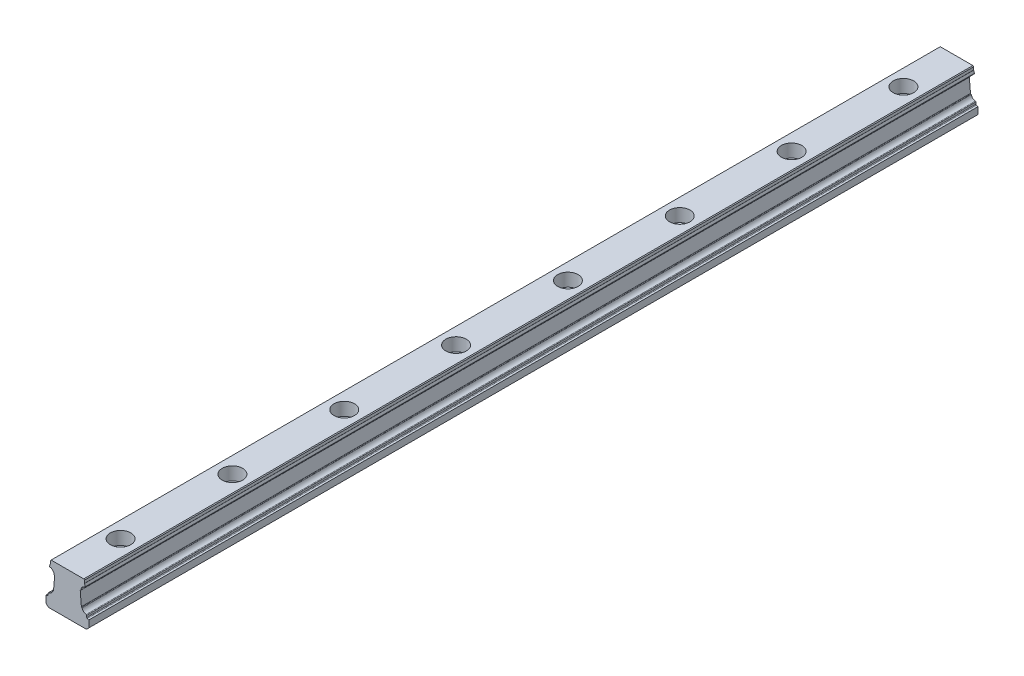
from build123d import *

# Parameters (mm, degrees)
EXTRUDE1_DEPTH                                      = 238.5
CBORE_FOR_M6_HEX_SOCKET_HEAD_CAP_SCREW1_D           = 6.6
CBORE_FOR_M6_HEX_SOCKET_HEAD_CAP_SCREW1_CBORE_D     = 11
CBORE_FOR_M6_HEX_SOCKET_HEAD_CAP_SCREW1_CBORE_DEPTH = 7
LPATTERN2_COUNT                                     = 8
LPATTERN2_PITCH                                     = 60


with BuildPart() as part:
    # Sketch1 → Extrude1 (new, symmetric)
    with BuildSketch(Plane.XY):
        with BuildLine():
            Line((7.477203841, -2.163774891), (6.854635535, 4.95221341))
            ThreePointArc((6.854635535, 4.95221341), (6.894238652, 5.113219257), (7.023920881, 5.216533386))
            ThreePointArc((7.023920881, 5.216533386), (7.143282835, 5.304921447), (7.19380984, 5.444588005))
            ThreePointArc((7.19380984, 5.444588005), (7.842791864, 6.982656014), (9.322818427, 7.754894477))
            ThreePointArc((9.322818427, 7.754894477), (9.570098719, 7.917497666), (9.598759922, 8.212058144))
            Line((9.598759922, 8.212058144), (9.174122952, 9.378738633))
            ThreePointArc((9.174122952, 9.378738633), (9.156076899, 9.446087419), (9.15, 9.51554669))
            Line((9.15, 9.51554669), (9.15, 10.95))
            Line((9.15, 10.95), (8.75, 11.35))
            Line((8.75, 11.35), (-8.75, 11.35))
            Line((-8.75, 11.35), (-9.15, 10.95))
            Line((-9.15, 10.95), (-9.15, 9.51554669))
            ThreePointArc((-9.15, 9.51554669), (-9.156076899, 9.446087419), (-9.174122952, 9.378738633))
            Line((-9.174122952, 9.378738633), (-9.598759922, 8.212058144))
            ThreePointArc((-9.598759922, 8.212058144), (-9.570098719, 7.917497666), (-9.322818427, 7.754894477))
            ThreePointArc((-9.322818427, 7.754894477), (-7.842791864, 6.982656014), (-7.19380984, 5.444588005))
            ThreePointArc((-7.19380984, 5.444588005), (-7.143282835, 5.304921447), (-7.023920881, 5.216533386))
            ThreePointArc((-7.023920881, 5.216533386), (-6.894238652, 5.113219257), (-6.854635535, 4.95221341))
            Line((-6.854635535, 4.95221341), (-7.477203841, -2.163774891))
            ThreePointArc((-7.477203841, -2.163774891), (-7.545812268, -2.317231314), (-7.694596885, -2.395456169))
            ThreePointArc((-7.694596885, -2.395456169), (-7.830767167, -2.461137392), (-7.906447862, -2.592014437))
            ThreePointArc((-7.906447862, -2.592014437), (-8.667010877, -3.879124842), (-10.031407356, -4.49029711))
            ThreePointArc((-10.031407356, -4.49029711), (-10.248539262, -4.602670084), (-10.3356733, -4.831103027))
            Line((-10.3356733, -4.831103027), (-10.3356733, -5.731088806))
            ThreePointArc((-10.3356733, -5.731088806), (-10.418331964, -5.974593377), (-10.632145682, -6.117459136))
            Line((-10.632145682, -6.117459136), (-11.5, -6.35))
            Line((-11.5, -6.35), (-11.5, -10.05))
            Line((-11.5, -10.05), (-10.2, -11.35))
            Line((-10.2, -11.35), (10.2, -11.35))
            Line((10.2, -11.35), (11.5, -10.05))
            Line((11.5, -10.05), (11.5, -6.35))
            Line((11.5, -6.35), (10.632145682, -6.117459136))
            ThreePointArc((10.632145682, -6.117459136), (10.418331964, -5.974593377), (10.3356733, -5.731088806))
            Line((10.3356733, -5.731088806), (10.3356733, -4.831103027))
            ThreePointArc((10.3356733, -4.831103027), (10.248539262, -4.602670084), (10.031407356, -4.49029711))
            ThreePointArc((10.031407356, -4.49029711), (8.667010877, -3.879124842), (7.906447862, -2.592014437))
            ThreePointArc((7.906447862, -2.592014437), (7.830767167, -2.461137392), (7.694596885, -2.395456169))
            ThreePointArc((7.694596885, -2.395456169), (7.545812268, -2.317231314), (7.477203841, -2.163774891))
        make_face()
    extrude(amount=EXTRUDE1_DEPTH, both=True)

    # CBORE for M6 Hex Socket Head Cap Screw1 (through all)
    with Locations(Plane(origin=(0, 11.35, 0), x_dir=(1, 0, 0), z_dir=(0, 1, 0))):
        with Locations((0, -210)):
            cbore_for_m6_hex_socket_head_cap_screw1 = CounterBoreHole(CBORE_FOR_M6_HEX_SOCKET_HEAD_CAP_SCREW1_D / 2, CBORE_FOR_M6_HEX_SOCKET_HEAD_CAP_SCREW1_CBORE_D / 2, CBORE_FOR_M6_HEX_SOCKET_HEAD_CAP_SCREW1_CBORE_DEPTH)

    # LPattern2: CBORE for M6 Hex Socket Head Cap Screw1 ×8
    with Locations(*[(0, 0, -i * LPATTERN2_PITCH) for i in range(1, LPATTERN2_COUNT)]):
        add(cbore_for_m6_hex_socket_head_cap_screw1, mode=Mode.SUBTRACT)


solid = part.part
